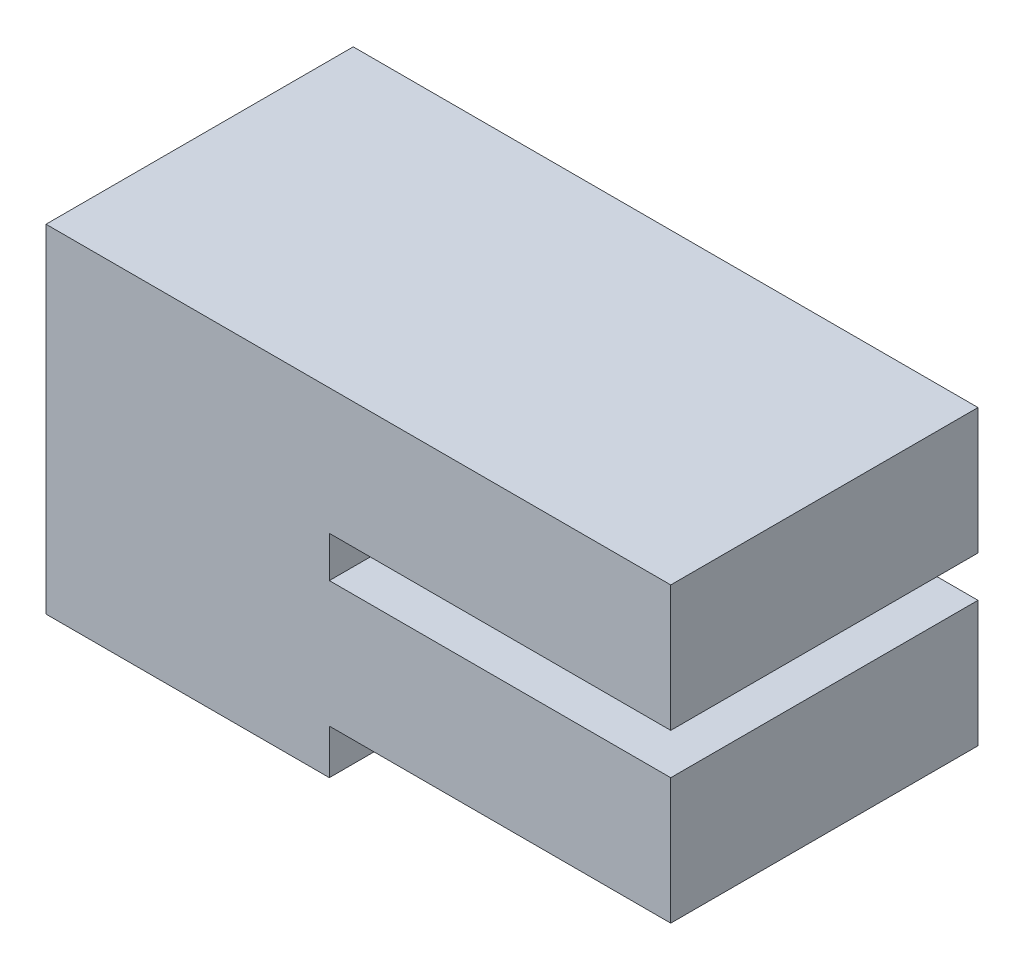
from build123d import *

# Parameters (mm, degrees)
SKETCH1_W           = 8.3
SKETCH1_H           = 9.8906033
BOSS_EXTRUDE1_DEPTH = 9
SKETCH2_W           = 10
SKETCH2_H           = 3.6906033
BOSS_EXTRUDE2_DEPTH = 9


with BuildPart() as part:
    # Sketch1 → Boss-Extrude1 (new body)
    with BuildSketch(Plane.XY):
        with Locations((4.15, 4.94530165)):
            Rectangle(SKETCH1_W, SKETCH1_H)
    extrude(amount=BOSS_EXTRUDE1_DEPTH)

    # Sketch2 → Boss-Extrude2 (add, through all)
    with BuildSketch(Plane.XY.offset(9)):
        with Locations((13.3, 8.04530165)):
            Rectangle(SKETCH2_W, SKETCH2_H)
        with Locations((13.3, 3.15469835)):
            Rectangle(SKETCH2_W, SKETCH2_H)
    extrude(amount=-BOSS_EXTRUDE2_DEPTH)


solid = part.part
